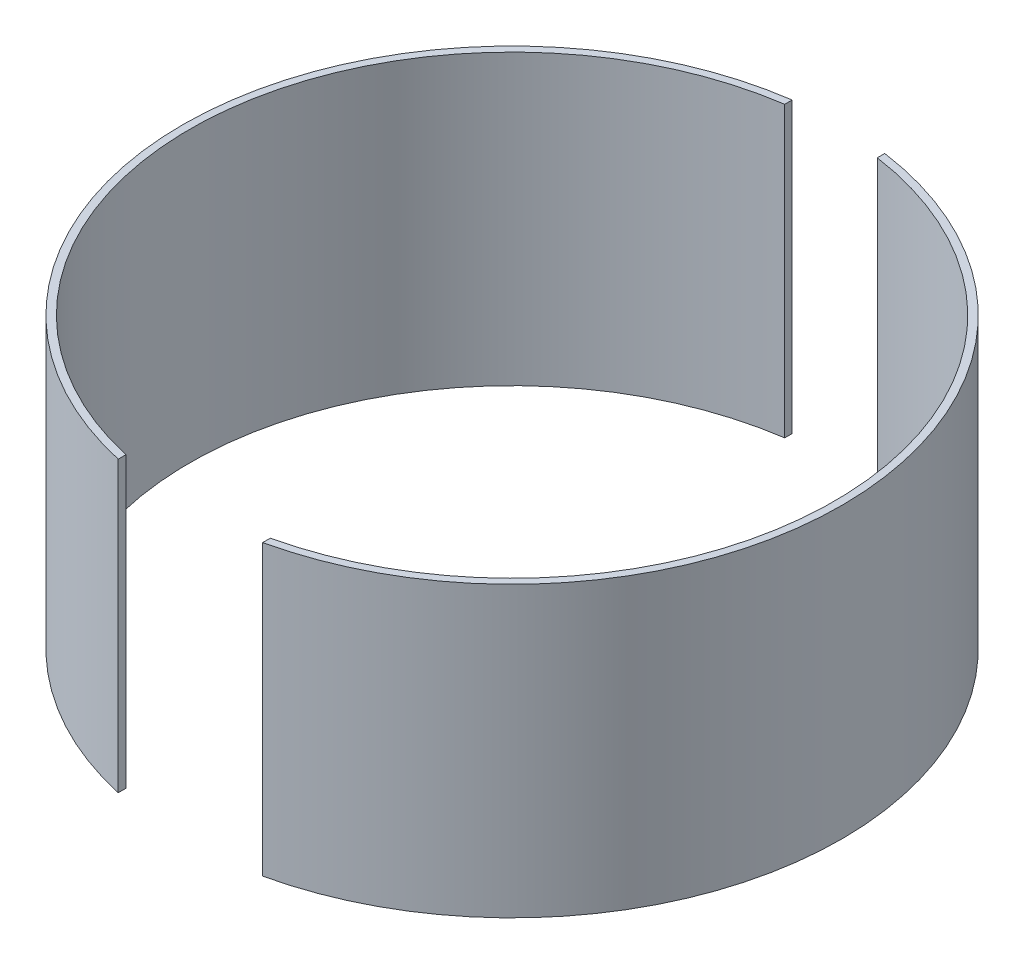
from build123d import *

# Parameters (mm, degrees)
SKETCH1_R           = 89
SKETCH1_R_2         = 87
BOSS_EXTRUDE1_DEPTH = 78
SKETCH2_W           = 25
SKETCH2_H           = 78
CUT_EXTRUDE1_DEPTH  = 100
SKETCH3_W           = 39
SKETCH3_H           = 78
CUT_EXTRUDE2_DEPTH  = 208


with BuildPart() as part:
    # Sketch1 → Boss-Extrude1 (new body)
    with BuildSketch(Plane(origin=(0, 0, 0), x_dir=(1, 0, 0), z_dir=(0, 1, 0))):
        with Locations(Location((0, 0, 0), (0, 0, 270))):
            Circle(SKETCH1_R)
        with Locations(Location((0, 0, 0), (0, 0, 270))):
            Circle(SKETCH1_R_2, mode=Mode.SUBTRACT)
    extrude(amount=BOSS_EXTRUDE1_DEPTH)

    # Sketch2 → Cut-Extrude1 (cut)
    with BuildSketch(Plane.XY):
        with Locations((0, 39)):
            Rectangle(SKETCH2_W, SKETCH2_H)
    extrude(amount=-CUT_EXTRUDE1_DEPTH, mode=Mode.SUBTRACT)

    # Sketch3 → Cut-Extrude2 (cut)
    with BuildSketch(Plane.XY):
        with Locations((0, 39)):
            Rectangle(SKETCH3_W, SKETCH3_H)
    extrude(amount=CUT_EXTRUDE2_DEPTH, mode=Mode.SUBTRACT)


with BuildPart() as cut_extrude2_piece_1:
    # of the separate pieces the step leaves, piece 1, a body of its own (cut_extrude2_pieces)
    add(part.part.solids().sort_by_distance((-12.5, 0, -86.097328646))[0])


with BuildPart() as cut_extrude2_piece_2:
    # of the separate pieces the step leaves, piece 2, a body of its own (cut_extrude2_pieces)
    add(part.part.solids().sort_by_distance((19.5, 0, 86.837491903))[0])


solid = Compound([cut_extrude2_piece_1.part, cut_extrude2_piece_2.part])
